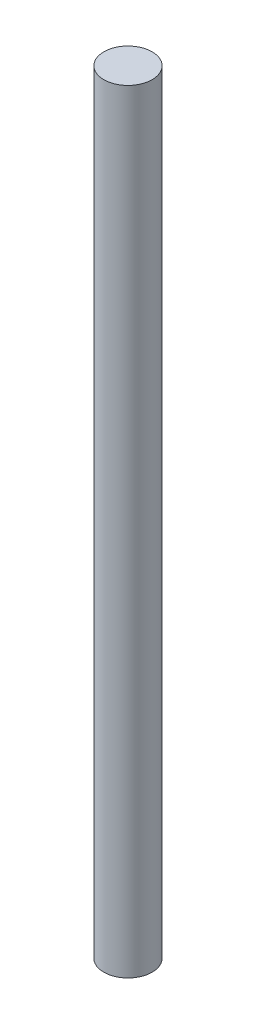
from build123d import *

# Parameters (mm, degrees)
SKETCH1_R           = 6.35
BOSS_EXTRUDE1_DEPTH = 203.2


with BuildPart() as part:
    # Sketch1 → Boss-Extrude1 (new body)
    with BuildSketch(Plane(origin=(0, 0, 0), x_dir=(1, 0, 0), z_dir=(0, 1, 0))):
        with Locations(Location((0, 0, 0), (0, 0, 270))):
            Circle(SKETCH1_R)
    extrude(amount=BOSS_EXTRUDE1_DEPTH)


solid = part.part
